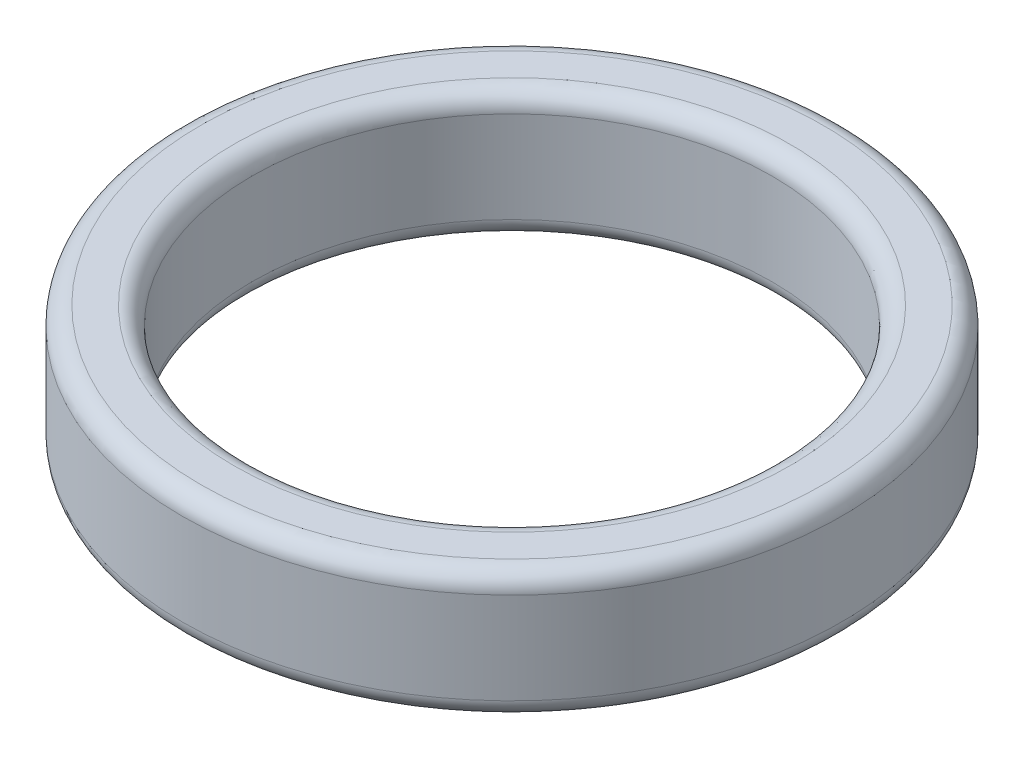
from build123d import *

# Parameters (mm, degrees)
SKETCH_1_R      = 9
SKETCH_1_R_2    = 7.1
EXTRUDE_1_DEPTH = 3.5
FILLET_1_R      = 0.5


with BuildPart() as part:
    # Эскиз1 → Бобышка-Вытянуть1 (new body)
    with BuildSketch(Plane(origin=(0, 0, 0), x_dir=(1, 0, 0), z_dir=(0, 1, 0))):
        with Locations(Location((0, 0, 0), (0, 0, 270))):
            Circle(SKETCH_1_R)
        with Locations(Location((0, 0, 0), (0, 0, 270))):
            Circle(SKETCH_1_R_2, mode=Mode.SUBTRACT)
    extrude(amount=EXTRUDE_1_DEPTH)

    # Скругление1
    fillet_1_edges = [part.edges().sort_by_distance(p)[0] for p in [
        (0, 0, -9),
        (0, 3.5, -9),
        (0, 0, -7.1),
        (0, 3.5, -7.1),
    ]]
    fillet(fillet_1_edges, radius=FILLET_1_R)


solid = part.part
